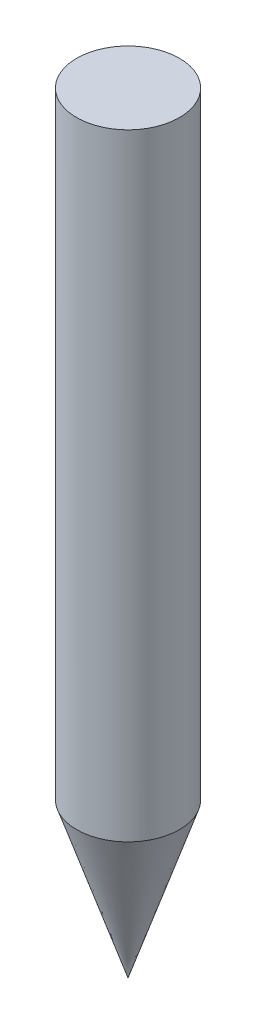
from build123d import *


with BuildPart() as part:
    # Sketch1 → Revolve1 (revolve)
    with BuildSketch(Plane.XY, mode=Mode.PRIVATE) as revolve1_sk:
        Polygon((0, 0), (4, 12), (4, 60), (0, 60), align=None)
    revolve(revolve1_sk.sketch.rotate(Axis((0, 0, 0), (0, 1, 0)), 90), axis=Axis((0, 0, 0), (0, 1, 0)))


solid = part.part
